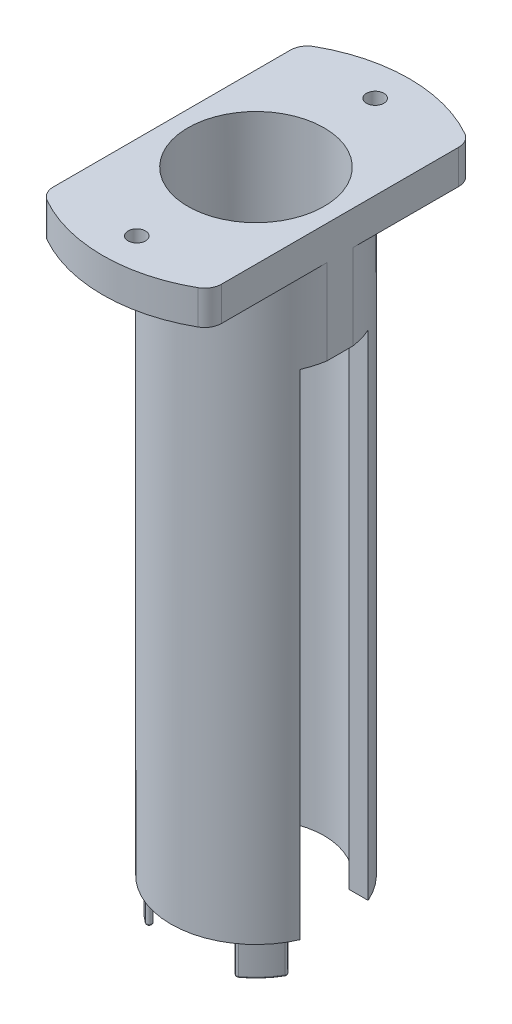
from build123d import *

# Parameters (mm, degrees)
SKETCH_3_R          = 25
EXTRUDE_1_DEPTH     = 340
SKETCH_6_R          = 45
EXTRUDE_2_DEPTH     = 10
EXTRUDE_START       = 10
SKETCH_7_R          = 45
EXTRUDE_3_DEPTH     = 10
SKETCH_4_R          = 20
CUT_EXTRUDE_1_DEPTH = 366.581728209
SKETCH_8_W          = 40.591982286
SKETCH_8_H          = 75.225313462
CUT_EXTRUDE_2_DEPTH = 366.581728209
SKETCH_9_W          = 20
SKETCH_9_H          = 290
CUT_EXTRUDE_3_DEPTH = 357.405667744
M6X1_0_1_D          = 5
FILLET_1_R          = 5
SKETCH_12_R         = 2.55
CUT_EXTRUDE_4_DEPTH = 364.641702853
SKETCH_13_W         = 245.746793121
SKETCH_13_H         = 335.021693113
CUT_EXTRUDE_5_DEPTH = 180
CUT_EXTRUDE_7_DEPTH = 30
EXTRUDE_4_DEPTH     = 10
FILLET_5_R          = 0.5
FILLET_6_R          = 0.5


with BuildPart() as part:
    # 草图3 → 凸台-拉伸1 (new body)
    with BuildSketch(Plane(origin=(0, 0, 0), x_dir=(1, 0, 0), z_dir=(0, 1, 0))):
        with Locations(Location((0, 0, 0), (0, 0, 270))):
            Circle(SKETCH_3_R)
    extrude(amount=EXTRUDE_1_DEPTH)

    # 草图6 → 凸台-拉伸2 (add)
    with BuildSketch(Plane.XZ):
        with Locations(Location((0, 0, 0), (0, 0, 270))):
            Circle(SKETCH_6_R)
    extrude(amount=EXTRUDE_2_DEPTH)

    # 草图7 → 凸台-拉伸3 (add)
    with BuildSketch(Plane(origin=(0, 340, 0), x_dir=(1, 0, 0), z_dir=(0, 1, 0)).offset(EXTRUDE_START)):
        with Locations(Location((0, 0, 0), (0, 0, 90))):
            Circle(SKETCH_7_R)
    extrude(amount=-EXTRUDE_3_DEPTH)

    # 草图4 → 切除-拉伸1 (cut, through all)
    with BuildSketch(Plane.XZ.offset(10)):
        with Locations(Location((0, 0, 0), (0, 0, 270))):
            Circle(SKETCH_4_R)
    extrude(amount=-CUT_EXTRUDE_1_DEPTH, mode=Mode.SUBTRACT)

    # 草图8 → 切除-拉伸2 (cut, through all)
    with BuildSketch(Plane(origin=(0, 350, 0), x_dir=(1, 0, 0), z_dir=(0, 1, 0))):
        with Locations((45, 0)):
            Rectangle(SKETCH_8_W, SKETCH_8_H)
    cut_extrude_2 = extrude(amount=-CUT_EXTRUDE_2_DEPTH, mode=Mode.SUBTRACT)

    # 草图9 → 切除-拉伸3 (cut, through all)
    with BuildSketch(Plane(origin=(-25.295991143, 0, 0), x_dir=(0, 0, -1), z_dir=(1, 0, 0))):
        with Locations((0, 170)):
            Rectangle(SKETCH_9_W, SKETCH_9_H)
    extrude(amount=CUT_EXTRUDE_3_DEPTH, mode=Mode.SUBTRACT)

    # M6x1.0 螺纹孔1 (through all)
    with Locations(Plane(origin=(0, 350, 0), x_dir=(1, 0, 0), z_dir=(0, 1, 0))):
        with Locations((0, -35), (0, 35)):
            Hole(M6X1_0_1_D / 2)

    # 镜向1: 切除-拉伸2 across plane
    add(cut_extrude_2.mirror(Plane(origin=(0, 0, 0), x_dir=(0, 0, 1), z_dir=(1, 0, 0))), mode=Mode.SUBTRACT)

    # 圆角1
    fillet_1_edges = [part.edges().sort_by_distance(p)[0] for p in [
        (-24.704008857, -5, -37.612656731),
        (-24.704008857, 345, -37.612656731),
        (-24.704008857, -5, 37.612656731),
        (-24.704008857, 345, 37.612656731),
        (24.704008857, -5, 37.612656731),
        (24.704008857, 345, 37.612656731),
        (24.704008857, -5, -37.612656731),
        (24.704008857, 345, -37.612656731),
    ]]
    fillet(fillet_1_edges, radius=FILLET_1_R)

    # 草图12 → 切除-拉伸4 (cut, through all)
    with BuildSketch(Plane(origin=(0, 350, 0), x_dir=(1, 0, 0), z_dir=(0, 1, 0))):
        with Locations(Location((0, 35, 0), (0, 0, 270))):
            Circle(SKETCH_12_R)
        with Locations(Location((0, -35, 0), (0, 0, 270))):
            Circle(SKETCH_12_R)
    extrude(amount=-CUT_EXTRUDE_4_DEPTH, mode=Mode.SUBTRACT)

    # 草图13 → 切除-拉伸5 (cut)
    with BuildSketch(Plane.XZ.offset(10)):
        with Locations((-21.384575648, -11.685004811)):
            Rectangle(SKETCH_13_W, SKETCH_13_H)
    extrude(amount=-CUT_EXTRUDE_5_DEPTH, mode=Mode.SUBTRACT)

    # 草图16 → 切除-拉伸7 (cut)
    with BuildSketch(Plane.XZ.offset(-170)):
        with BuildLine():
            ThreePointArc((-20.321384852, -11.732557014), (-17.43797807, -15.701225978), (-13.79244797, -18.983676024))
            ThreePointArc((-13.79244797, -18.983676024), (-12.395645723, -18.762444282), (-12.616877465, -17.365642036))
            ThreePointArc((-12.616877465, -17.365642036), (-15.951688419, -14.362964766), (-18.589334044, -10.732557014))
            ThreePointArc((-18.589334044, -10.732557014), (-19.955359448, -10.366531611), (-20.321384852, -11.732557014))
        make_face()
        with BuildLine():
            ThreePointArc((13.79244797, -18.983676024), (17.43797807, -15.701225978), (20.321384852, -11.732557014))
            ThreePointArc((20.321384852, -11.732557014), (19.955359448, -10.366531611), (18.589334044, -10.732557014))
            ThreePointArc((18.589334044, -10.732557014), (15.951688419, -14.362964766), (12.616877465, -17.365642036))
            ThreePointArc((12.616877465, -17.365642036), (12.395645723, -18.762444282), (13.79244797, -18.983676024))
        make_face()
    extrude(amount=-CUT_EXTRUDE_7_DEPTH, mode=Mode.SUBTRACT)

    # 草图17 → 凸台-拉伸4 (add)
    with BuildSketch(Plane.XZ.offset(-170)):
        with BuildLine():
            ThreePointArc((20.148179771, 11.632557014), (17.289349105, 15.567399857), (13.674890919, 18.821872625))
            ThreePointArc((13.674890919, 18.821872625), (12.557449122, 18.644887232), (12.734434515, 17.527445434))
            ThreePointArc((12.734434515, 17.527445434), (16.100317384, 14.496790887), (18.762539125, 10.832557014))
            ThreePointArc((18.762539125, 10.832557014), (19.855359448, 10.539736691), (20.148179771, 11.632557014))
        make_face()
        with BuildLine():
            ThreePointArc((-13.674890919, 18.821872625), (-17.289349105, 15.567399857), (-20.148179771, 11.632557014))
            ThreePointArc((-20.148179771, 11.632557014), (-19.855359448, 10.539736691), (-18.762539125, 10.832557014))
            ThreePointArc((-18.762539125, 10.832557014), (-16.100317384, 14.496790887), (-12.734434515, 17.527445434))
            ThreePointArc((-12.734434515, 17.527445434), (-12.557449122, 18.644887232), (-13.674890919, 18.821872625))
        make_face()
    extrude(amount=EXTRUDE_4_DEPTH)

    # 圆角5
    fillet_5_edges = [part.edges().sort_by_distance(p)[0] for p in [
        (-12.557449122, 160, 18.644887232),
        (-17.289349105, 160, 15.567399857),
        (-19.855359448, 160, 10.539736691),
        (-16.100317384, 160, 14.496790887),
    ]]
    fillet(fillet_5_edges, radius=FILLET_5_R)

    # 圆角6
    fillet_6_edges = [part.edges().sort_by_distance(p)[0] for p in [
        (19.855359448, 160, 10.539736691),
        (17.289349105, 160, 15.567399857),
        (12.557449122, 160, 18.644887232),
        (16.100317384, 160, 14.496790887),
    ]]
    fillet(fillet_6_edges, radius=FILLET_6_R)


solid = part.part
